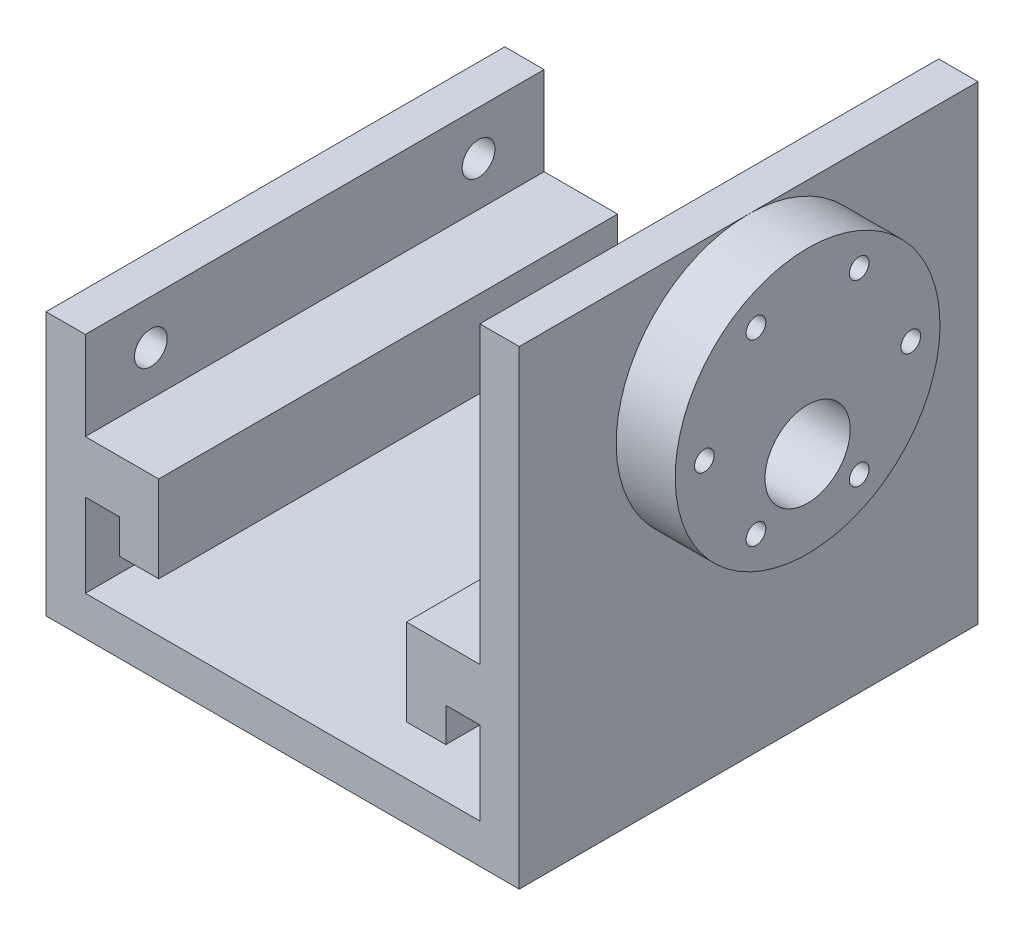
from build123d import *

# Parameters (mm, degrees)
BOSS_EXTRUDE1_DEPTH  = 70
SKETCH2_R            = 1.5
CUT_EXTRUDE1_DEPTH   = 6
LPATTERN1_COUNT      = 4
LPATTERN1_PITCH      = 14
LPATTERN1_COUNT_DIR2 = 2
LPATTERN1_PITCH_DIR2 = 55
CIRPATTERN2_COUNT    = 6
SKETCH10_R           = 6.5
CUT_EXTRUDE4_DEPTH   = 10
SKETCH11_R           = 20.2
SKETCH11_R_2         = 1.5
SKETCH11_R_3         = 6.5
BOSS_EXTRUDE6_DEPTH  = 9
SKETCH12_W           = 70
SKETCH12_H           = 13.5
SKETCH12_R           = 2.5
BOSS_EXTRUDE7_DEPTH  = 6


with BuildPart() as part:
    # Sketch1 → Boss-Extrude1 (new body)
    with BuildSketch(Plane.XY):
        Polygon((0, 26.7), (0, 0), (72.2, 0), (72.2, 71.7), (66.2, 71.7), (66.2, 26.7), (55, 26.7), (55, 13.5), (61, 13.5), (61, 18.7), (66.2, 18.7), (66.2, 6), (6, 6), (6, 18.7), (11.2, 18.7), (11.2, 13.5), (17.2, 13.5), (17.2, 26.7), align=None)
    extrude(amount=BOSS_EXTRUDE1_DEPTH)

    # Sketch2 → Cut-Extrude1 (cut)
    with BuildSketch(Plane.ZY.offset(-66.2)):
        with Locations(Location((50.75, 51.5, 0), (0, 0, 270))):
            Circle(SKETCH2_R)
    cut_extrude1 = extrude(amount=-CUT_EXTRUDE1_DEPTH, mode=Mode.SUBTRACT)

    # Sketch3 → Cut-Revolve1 (revolve, cut)
    with BuildSketch(Plane.XZ.offset(-18.7)):
        with BuildLine():
            Line((61.1, 56), (66.1, 56))
            ThreePointArc((66.1, 56), (63.6, 58.5), (61.1, 56))
        make_face()
    cut_revolve1 = revolve(axis=Axis((61.1, 18.7, 56), (1, 0, 0)), mode=Mode.SUBTRACT)

    # LPattern1: Cut-Revolve1 4 × 2
    with Locations(*[(-j * LPATTERN1_PITCH_DIR2, 0, -i * LPATTERN1_PITCH) for i in range(LPATTERN1_COUNT) for j in range(LPATTERN1_COUNT_DIR2) if (i, j) != (0, 0)]):
        add(cut_revolve1, mode=Mode.SUBTRACT)

    # CirPattern2: Cut-Extrude1 ×6 about axis
    cirpattern2_axis = Axis((0, 51.5, 35), (1, 0, 0))
    for i in range(1, CIRPATTERN2_COUNT):
        add(cut_extrude1.rotate(cirpattern2_axis, i * 360 / CIRPATTERN2_COUNT), mode=Mode.SUBTRACT)

    # Sketch10 → Cut-Extrude4 (cut)
    with BuildSketch(Plane.ZY.offset(-66.2)):
        with Locations((35, 44.5)):
            Circle(SKETCH10_R)
    extrude(amount=-CUT_EXTRUDE4_DEPTH, mode=Mode.SUBTRACT)

    # Sketch11 → Boss-Extrude6 (add)
    with BuildSketch(Plane(origin=(72.2, 0, 0), x_dir=(0, 0, -1), z_dir=(1, 0, 0))):
        with Locations(Location((-35, 51.5, 0), (0, 0, 90))):
            Circle(SKETCH11_R)
        with Locations(Location((-42.875, 65.13990011, 0), (0, 0, 210))):
            Circle(SKETCH11_R_2, mode=Mode.SUBTRACT)
        with Locations(Location((-27.125, 65.13990011, 0), (0, 0, 150))):
            Circle(SKETCH11_R_2, mode=Mode.SUBTRACT)
        with Locations(Location((-19.25, 51.5, 0), (0, 0, 90))):
            Circle(SKETCH11_R_2, mode=Mode.SUBTRACT)
        with Locations(Location((-27.125, 37.86009989, 0), (0, 0, 90))):
            Circle(SKETCH11_R_2, mode=Mode.SUBTRACT)
        with Locations(Location((-35, 44.5, 0), (0, 0, 180))):
            Circle(SKETCH11_R_3, mode=Mode.SUBTRACT)
        with Locations(Location((-42.875, 37.86009989, 0), (0, 0, 90))):
            Circle(SKETCH11_R_2, mode=Mode.SUBTRACT)
        with Locations(Location((-50.75, 51.5, 0), (0, 0, 270))):
            Circle(SKETCH11_R_2, mode=Mode.SUBTRACT)
    extrude(amount=BOSS_EXTRUDE6_DEPTH)

    # Sketch12 → Boss-Extrude7 (add)
    with BuildSketch(Plane(origin=(0, 0, 70), x_dir=(0, 0, -1), z_dir=(1, 0, 0))):
        with Locations((35, 33.45)):
            Rectangle(SKETCH12_W, SKETCH12_H)
        with Locations(Location((10, 33.45, 0), (0, 0, 270))):
            Circle(SKETCH12_R, mode=Mode.SUBTRACT)
        with Locations(Location((60, 33.45, 0), (0, 0, 270))):
            Circle(SKETCH12_R, mode=Mode.SUBTRACT)
    extrude(amount=BOSS_EXTRUDE7_DEPTH)


solid = part.part
